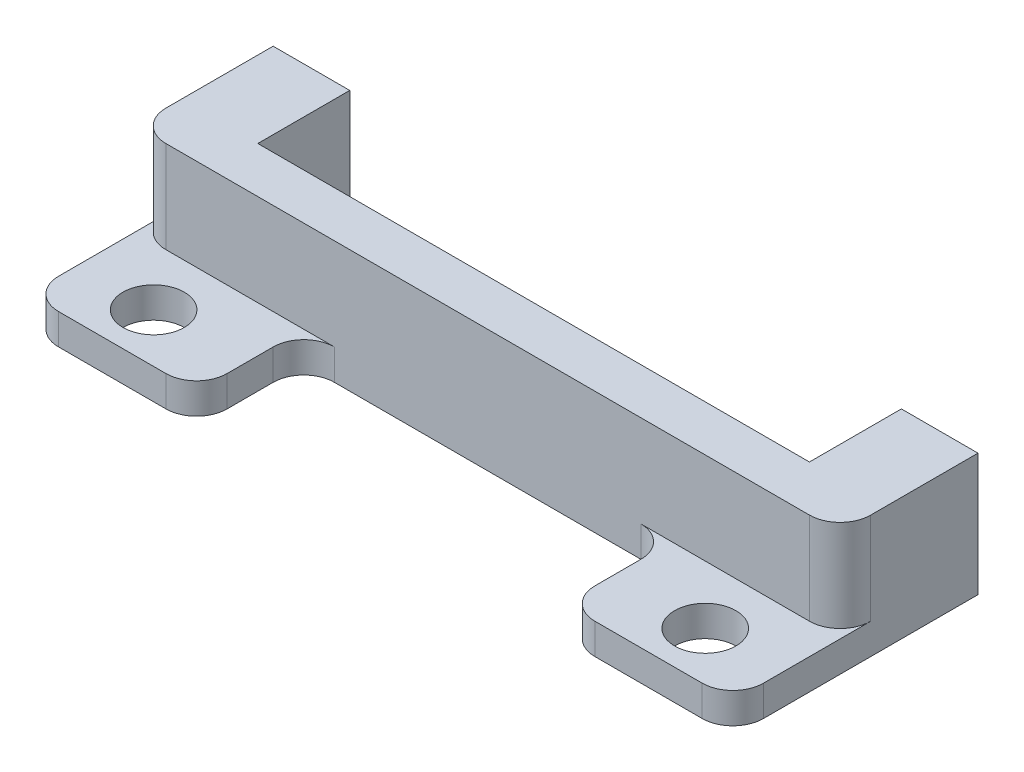
from build123d import *

# Parameters (mm, degrees)
BOSS_EXTRUDE1_DEPTH = 2
BOSS_EXTRUDE2_DEPTH = 6
FILLET1_R           = 2
SKETCH4_R           = 2
CUT_EXTRUDE1_DEPTH  = 50.071376586
SKETCH7_W           = 24
SKETCH7_H           = 7
CUT_EXTRUDE2_DEPTH  = 50.071376586
FILLET2_R           = 2


with BuildPart() as part:
    # Sketch1 → Boss-Extrude1 (new body)
    with BuildSketch(Plane(origin=(0, 0, 0), x_dir=(1, 0, 0), z_dir=(0, 1, 0))):
        Polygon((0, 0), (5, 0), (5, -6), (41, -6), (41, 0), (46, 0), (46, -16), (0, -16), align=None)
    extrude(amount=BOSS_EXTRUDE1_DEPTH)

    # Sketch2 → Boss-Extrude2 (add)
    with BuildSketch(Plane(origin=(0, 2, 0), x_dir=(1, 0, 0), z_dir=(0, 1, 0))):
        Polygon((0, 0), (0, -9), (46, -9), (46, 0), (41, 0), (41, -6), (5, -6), (5, 0), align=None)
    extrude(amount=BOSS_EXTRUDE2_DEPTH)

    # Fillet1
    fillet1_edges = [part.edges().sort_by_distance(p)[0] for p in [
        (46, 1, 16),
        (0, 1, 16),
        (0, 5, 9),
        (46, 5, 9),
    ]]
    fillet(fillet1_edges, radius=FILLET1_R)

    # Sketch4 → Cut-Extrude1 (cut, through all)
    with BuildSketch(Plane(origin=(0, 2, 0), x_dir=(1, 0, 0), z_dir=(0, 1, 0))):
        with Locations(Location((5, -12.8, 0), (0, 0, 270))):
            Circle(SKETCH4_R)
        with Locations(Location((41, -12.8, 0), (0, 0, 90))):
            Circle(SKETCH4_R)
    extrude(amount=-CUT_EXTRUDE1_DEPTH, mode=Mode.SUBTRACT)

    # Sketch7 → Cut-Extrude2 (cut, through all)
    with BuildSketch(Plane(origin=(0, 2, 0), x_dir=(1, 0, 0), z_dir=(0, 1, 0))):
        with Locations((23, -12.5)):
            Rectangle(SKETCH7_W, SKETCH7_H)
    extrude(amount=-CUT_EXTRUDE2_DEPTH, mode=Mode.SUBTRACT)

    # Fillet2
    fillet2_edges = [part.edges().sort_by_distance(p)[0] for p in [
        (35, 1, 16),
        (11, 1, 16),
        (11, 1, 9),
        (35, 1, 9),
    ]]
    fillet(fillet2_edges, radius=FILLET2_R)


solid = part.part
